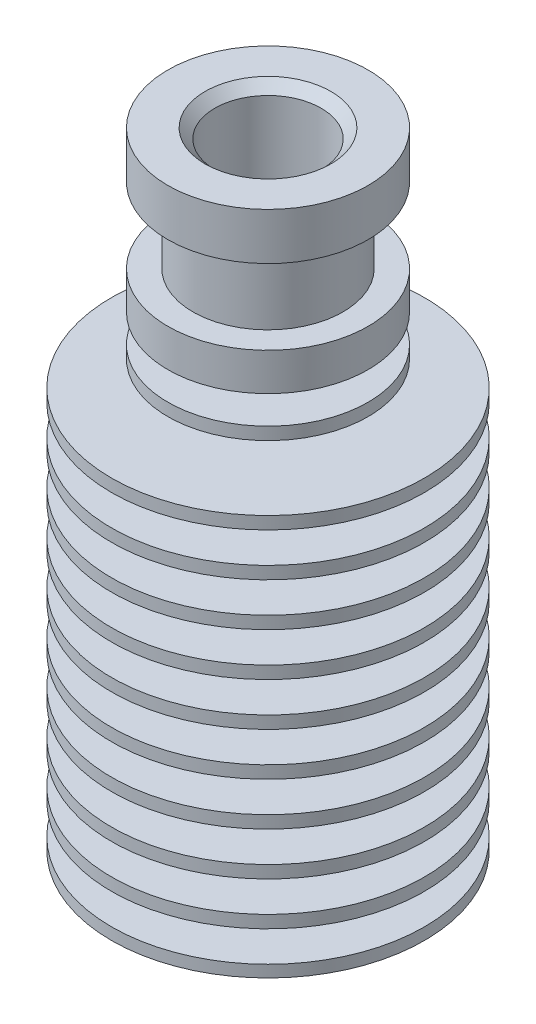
from build123d import *

# Parameters (mm, degrees)
SZKIC2_W                          = 2
SZKIC2_H                          = 6
SZKIC3_W                          = 3.5
SZKIC3_H                          = 2.25
SZKIC3_H_2                        = 2
SZKIC4_W                          = 8
SZKIC4_H                          = 2.45
SZKIC5_W                          = 6.5
SZKIC5_H                          = 2.45
SZKIC6_W                          = 5.5
SZKIC6_H                          = 2.45
OTW_R_GWINTOWANY_M61_D            = 5
OTW_R_GWINTOWANY_M61_DEPTH        = 27.5
OTW_R_GWINTOWANY_M61_CSINK_D      = 6.05
OTW_R_GWINTOWANY_M61_CSINK_ANGLE  = 90
OTW_R_GWINTOWANY_M61_TIP          = 1.502151548
OTW_R_GWINTOWANY_M102_D           = 8.5
OTW_R_GWINTOWANY_M102_DEPTH       = 10
OTW_R_GWINTOWANY_M102_CSINK_D     = 10.05
OTW_R_GWINTOWANY_M102_CSINK_ANGLE = 90
OTW_R_GWINTOWANY_M102_TIP         = 2.553657631
WYTNIJ_WYCI_GNI_CIE1_REACH        = 55.033
SZKIC14_R                         = 0.95


with BuildPart() as part:
    # Szkic1 → Obrót1 (revolve)
    with BuildSketch(Plane.XY, mode=Mode.PRIVATE) as obr_t1_sk:
        Polygon((0, 0), (-12.5, 0), (-12.5, 32), (-8, 32), (-8, 50), (0, 50), align=None)
    revolve(obr_t1_sk.sketch.rotate(Axis((0, 50, 0), (0, -1, 0)), 270), axis=Axis((0, 50, 0), (0, -1, 0)))

    # Szkic2 → Wycięcie-obrót1 (revolve, cut)
    with BuildSketch(Plane.XY, mode=Mode.PRIVATE) as wyci_cie_obr_t1_sk:
        with Locations((-7, 43.25)):
            Rectangle(SZKIC2_W, SZKIC2_H)
    revolve(wyci_cie_obr_t1_sk.sketch.rotate(Axis((0, 46.25, 0), (0, -1, 0)), 270), axis=Axis((0, 46.25, 0), (0, -1, 0)), mode=Mode.SUBTRACT)

    # Szkic3 → Wycięcie-obrót2 (revolve, cut)
    with BuildSketch(Plane.XY, mode=Mode.PRIVATE) as wyci_cie_obr_t2_sk:
        with Locations((-6.25, 36.125)):
            Rectangle(SZKIC3_W, SZKIC3_H)
        with Locations((-6.25, 33)):
            Rectangle(SZKIC3_W, SZKIC3_H_2)
    revolve(wyci_cie_obr_t2_sk.sketch.rotate(Axis((0, 32, 0), (0, 1, 0)), 270), axis=Axis((0, 32, 0), (0, 1, 0)), mode=Mode.SUBTRACT)

    # Szkic4 → Wycięcie-obrót3 (revolve, cut)
    with BuildSketch(Plane.XY, mode=Mode.PRIVATE) as wyci_cie_obr_t3_sk:
        with Locations((-8.5, 29.775)):
            Rectangle(SZKIC4_W, SZKIC4_H)
        with Locations((-8.5, 26.325)):
            Rectangle(SZKIC4_W, SZKIC4_H)
        with Locations((-8.5, 22.875)):
            Rectangle(SZKIC4_W, SZKIC4_H)
    revolve(wyci_cie_obr_t3_sk.sketch.rotate(Axis((0, 0, 0), (0, 1, 0)), 270), axis=Axis((0, 0, 0), (0, 1, 0)), mode=Mode.SUBTRACT)

    # Szkic5 → Wycięcie-obrót4 (revolve, cut)
    with BuildSketch(Plane.XY, mode=Mode.PRIVATE) as wyci_cie_obr_t4_sk:
        with Locations((-9.25, 19.425)):
            Rectangle(SZKIC5_W, SZKIC5_H)
    revolve(wyci_cie_obr_t4_sk.sketch.rotate(Axis((0, 50, 0), (0, 1, 0)), 270), axis=Axis((0, 50, 0), (0, 1, 0)), mode=Mode.SUBTRACT)

    # Szkic6 → Wycięcie-obrót5 (revolve, cut)
    with BuildSketch(Plane.XY, mode=Mode.PRIVATE) as wyci_cie_obr_t5_sk:
        with Locations((-9.75, 15.975)):
            Rectangle(SZKIC6_W, SZKIC6_H)
        with Locations((-9.75, 12.525)):
            Rectangle(SZKIC6_W, SZKIC6_H)
        with Locations((-9.75, 9.075)):
            Rectangle(SZKIC6_W, SZKIC6_H)
        with Locations((-9.75, 5.625)):
            Rectangle(SZKIC6_W, SZKIC6_H)
        with Locations((-9.75, 2.175)):
            Rectangle(SZKIC6_W, SZKIC6_H)
    revolve(wyci_cie_obr_t5_sk.sketch.rotate(Axis((0, 50, 0), (0, 1, 0)), 270), axis=Axis((0, 50, 0), (0, 1, 0)), mode=Mode.SUBTRACT)

    # Otwór gwintowany M61
    with Locations(Plane(origin=(0, 0, 0), x_dir=(-1, 0, 0), z_dir=(0, -1, 0))):
        with Locations((0, 0)):
            CounterSinkHole(OTW_R_GWINTOWANY_M61_D / 2, OTW_R_GWINTOWANY_M61_CSINK_D / 2, depth=OTW_R_GWINTOWANY_M61_DEPTH, counter_sink_angle=OTW_R_GWINTOWANY_M61_CSINK_ANGLE)
            with Locations((0, 0, -(OTW_R_GWINTOWANY_M61_DEPTH + OTW_R_GWINTOWANY_M61_TIP / 2))):  # 118° drill point
                Cone(0, OTW_R_GWINTOWANY_M61_D / 2, OTW_R_GWINTOWANY_M61_TIP, mode=Mode.SUBTRACT)

    # Otwór gwintowany M102
    with Locations(Plane(origin=(0, 50, 0), x_dir=(1, 0, 0), z_dir=(0, 1, 0))):
        with Locations((0, 0)):
            CounterSinkHole(OTW_R_GWINTOWANY_M102_D / 2, OTW_R_GWINTOWANY_M102_CSINK_D / 2, depth=OTW_R_GWINTOWANY_M102_DEPTH, counter_sink_angle=OTW_R_GWINTOWANY_M102_CSINK_ANGLE)
            with Locations((0, 0, -(OTW_R_GWINTOWANY_M102_DEPTH + OTW_R_GWINTOWANY_M102_TIP / 2))):  # 118° drill point
                Cone(0, OTW_R_GWINTOWANY_M102_D / 2, OTW_R_GWINTOWANY_M102_TIP, mode=Mode.SUBTRACT)

    # Wytnij-wyciągnięcie1: up to this cone (the profile starts outside it)
    wytnij_wyci_gni_cie1_end = Plane(origin=(0, 50, 0), z_dir=(0, -1, 0)).offset(20.997849452) * Cone(1.664e-06, 57.47614414, 34.535150548, align=(Align.CENTER, Align.CENTER, Align.MIN), mode=Mode.PRIVATE)
    # Szkic14 → Wytnij-wyciągnięcie1 (cut, up to the surface)
    with BuildSketch(Plane(origin=(0, 50, 0), x_dir=(1, 0, 0), z_dir=(0, 1, 0)), mode=Mode.PRIVATE) as wytnij_wyci_gni_cie1_sk1:
        with Locations(Location((0, 0, 0), (0, 0, 270))):
            Circle(SZKIC14_R)
    wytnij_wyci_gni_cie1_tool1 = extrude(wytnij_wyci_gni_cie1_sk1.sketch, amount=-WYTNIJ_WYCI_GNI_CIE1_REACH, mode=Mode.PRIVATE) - wytnij_wyci_gni_cie1_end
    add(wytnij_wyci_gni_cie1_tool1.solids().sort_by_distance((0, 50, 0))[0], mode=Mode.SUBTRACT)


solid = part.part
